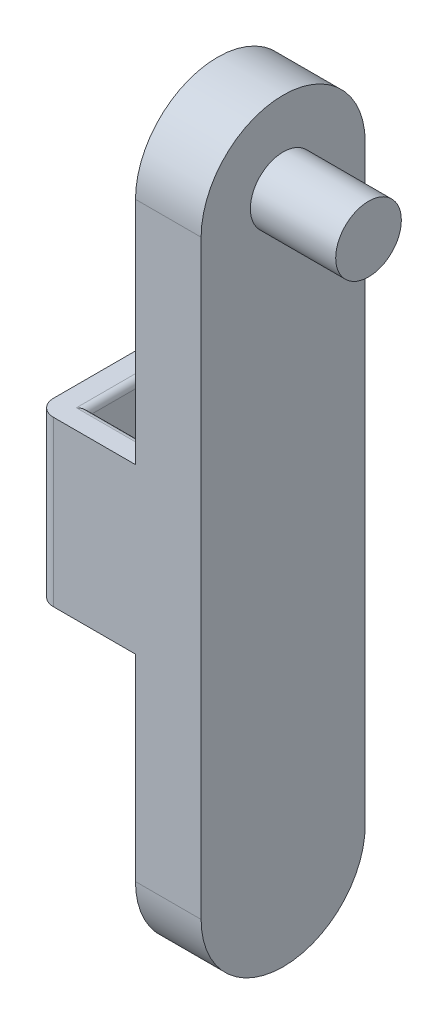
from build123d import *

# Parameters (mm, degrees)
BOSS_EXTRUDE1_DEPTH = 2
SKETCH2_R           = 1
BOSS_EXTRUDE2_DEPTH = 2.6
SKETCH3_W           = 3
SKETCH3_H           = 5
BOSS_EXTRUDE3_DEPTH = 5
SKETCH4_W           = 1.4
SKETCH4_H           = 3.4
CUT_EXTRUDE1_DEPTH  = 23.370784288
FILLET1_R           = 0.5
FILLET2_R           = 0.2


with BuildPart() as part:
    # Sketch1 → Boss-Extrude1 (new body)
    with BuildSketch(Plane(origin=(0, 0, 0), x_dir=(0, 0, -1), z_dir=(1, 0, 0))):
        with BuildLine():
            Line((-17.23490614, 15.515536013), (-17.23490614, -2.484463987))
            ThreePointArc((-17.23490614, -2.484463987), (-14.73490614, -4.984463987), (-12.23490614, -2.484463987))
            Line((-12.23490614, -2.484463987), (-12.23490614, 15.515536013))
            ThreePointArc((-12.23490614, 15.515536013), (-14.73490614, 18.015536013), (-17.23490614, 15.515536013))
        make_face()
    extrude(amount=BOSS_EXTRUDE1_DEPTH)

    # Sketch2 → Boss-Extrude2 (add)
    with BuildSketch(Plane(origin=(2, 0, 0), x_dir=(0, 0, -1), z_dir=(1, 0, 0))):
        with Locations(Location((-14.73490614, 15.515536013, 0), (0, 0, 180))):
            Circle(SKETCH2_R)
    extrude(amount=BOSS_EXTRUDE2_DEPTH)

    # Sketch3 → Boss-Extrude3 (add)
    with BuildSketch(Plane(origin=(0, 0, 12.23490614), x_dir=(-1, 0, 0), z_dir=(0, 0, -1))):
        with Locations((1.5, 6.015536013)):
            Rectangle(SKETCH3_W, SKETCH3_H)
    extrude(amount=-BOSS_EXTRUDE3_DEPTH)

    # Sketch4 → Cut-Extrude1 (cut, through all)
    with BuildSketch(Plane(origin=(0, 8.515536013, 0), x_dir=(1, 0, 0), z_dir=(0, 1, 0))):
        with Locations((-1.5, -14.73490614)):
            Rectangle(SKETCH4_W, SKETCH4_H)
    extrude(amount=-CUT_EXTRUDE1_DEPTH, mode=Mode.SUBTRACT)

    # Fillet1
    fillet1_edges = [part.edges().sort_by_distance(p)[0] for p in [
        (-3, 6.015536013, 12.23490614),
        (-3, 6.015536013, 17.23490614),
    ]]
    fillet(fillet1_edges, radius=FILLET1_R)

    # Fillet2
    fillet2_edges = [part.edges().sort_by_distance(p)[0] for p in [
        (-1.5, 3.515536013, 13.03490614),
        (-2.2, 3.515536013, 14.73490614),
        (-1.5, 3.515536013, 16.43490614),
        (-0.8, 3.515536013, 14.73490614),
        (-0.8, 8.515536013, 14.73490614),
        (-1.5, 8.515536013, 13.03490614),
        (-2.2, 8.515536013, 14.73490614),
        (-1.5, 8.515536013, 16.43490614),
    ]]
    fillet(fillet2_edges, radius=FILLET2_R)


solid = part.part
